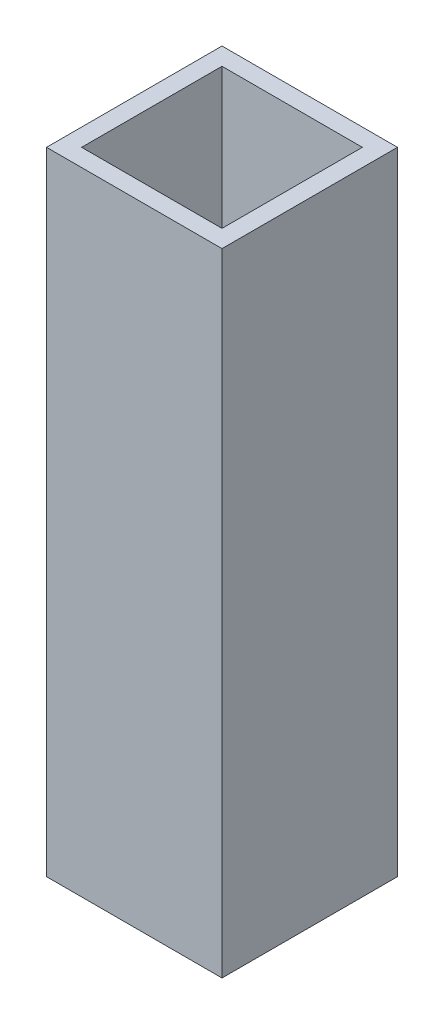
from build123d import *

# Parameters (mm, degrees)
SKETCH1_W          = 12.5
SKETCH1_H          = 12.5
CUVETTE_BODY_DEPTH = 45
SAMPLE_SPACE_START = 45
SKETCH2_W          = 10
SKETCH2_H          = 10
SAMPLE_SPACE_DEPTH = 43.75


with BuildPart() as part:
    # Sketch1 → Cuvette_Body (new body)
    with BuildSketch(Plane(origin=(0, 0, 0), x_dir=(1, 0, 0), z_dir=(0, 1, 0))):
        Rectangle(SKETCH1_W, SKETCH1_H)
    extrude(amount=CUVETTE_BODY_DEPTH)

    # Sketch2 → Sample_Space (cut)
    with BuildSketch(Plane(origin=(0, 0, 0), x_dir=(1, 0, 0), z_dir=(0, 1, 0)).offset(SAMPLE_SPACE_START)):
        Rectangle(SKETCH2_W, SKETCH2_H)
    extrude(amount=-SAMPLE_SPACE_DEPTH, mode=Mode.SUBTRACT)


solid = part.part
